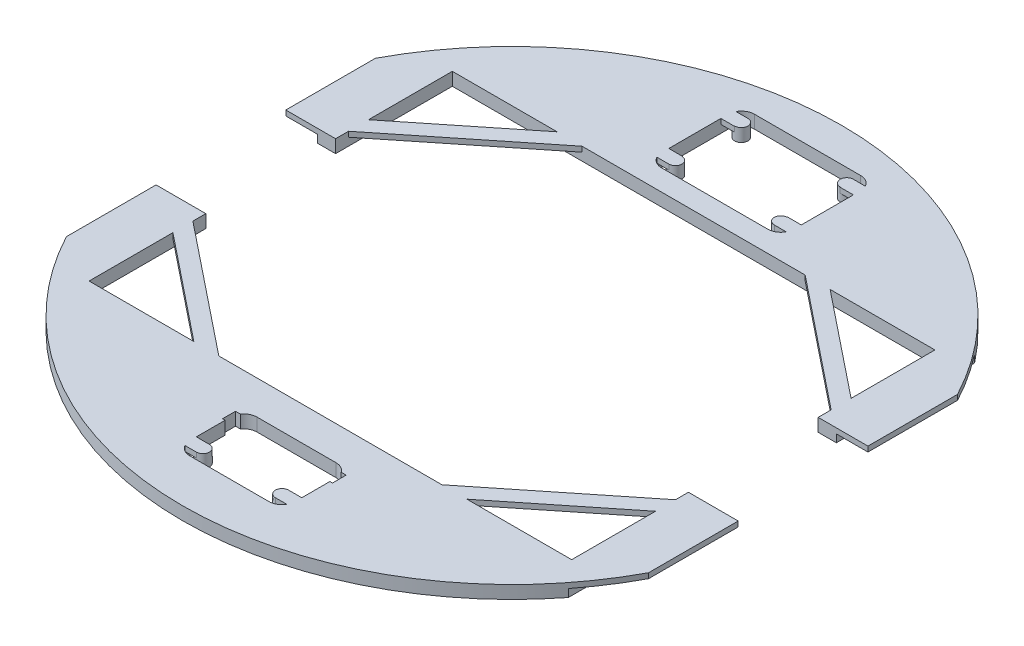
from build123d import *

# Parameters (mm, degrees)
SKETCH1_R           = 63.5
BOSS_EXTRUDE1_DEPTH = 2.5
CUT_EXTRUDE3_DEPTH  = 10
SKETCH2_W           = 93
SKETCH2_H           = 70
CUT_EXTRUDE4_DEPTH  = 1.5
CUT_EXTRUDE5_START  = -10
CUT_EXTRUDE5_DEPTH  = 10
SKETCH6_W           = 10
SKETCH6_H           = 26.950646815
CUT_EXTRUDE6_DEPTH  = 1.5
SKETCH7_R           = 1.27
CUT_EXTRUDE7_DEPTH  = 85.761427807
SKETCH8_W           = 2.6035
SKETCH8_H           = 2.6035
SKETCH8_W_2         = 2.54
SKETCH8_H_2         = 2.54
BOSS_EXTRUDE4_DEPTH = 1


with BuildPart() as part:
    # Sketch1 → Boss-Extrude1 (new body)
    with BuildSketch(Plane(origin=(0, 0, 0), x_dir=(1, 0, 0), z_dir=(0, 1, 0))):
        with Locations(Location((0, 0, 0), (0, 0, 270))):
            Circle(SKETCH1_R)
    extrude(amount=BOSS_EXTRUDE1_DEPTH)

    # Sketch4 → Cut-Extrude3 (cut)
    with BuildSketch(Plane(origin=(0, 2.5, 0), x_dir=(1, 0, 0), z_dir=(0, 1, 0))):
        Polygon((-46.5, 15), (-21.5, 35), (21.5, 35), (46.5, 15), (46.5, -15), (21.5, -35), (-21.5, -35), (-46.5, -15), align=None)
        Polygon((-46.5, 35), (-26.302343178, 35), (-46.5, 18.841874542), align=None)
        Polygon((-46.5, -35), (-26.302343178, -35), (-46.5, -18.841874542), align=None)
        Polygon((46.5, 35), (46.5, 18.841874542), (26.302343178, 35), align=None)
        Polygon((46.5, -18.841874542), (26.302343178, -35), (46.5, -35), align=None)
    extrude(amount=-CUT_EXTRUDE3_DEPTH, mode=Mode.SUBTRACT)

    # Sketch2 → Cut-Extrude4 (cut)
    with BuildSketch(Plane(origin=(0, 0, 0), x_dir=(1, 0, 0), z_dir=(0, 1, 0))):
        Rectangle(SKETCH2_W, SKETCH2_H)
    extrude(amount=CUT_EXTRUDE4_DEPTH, mode=Mode.SUBTRACT)

    # Sketch5 → Cut-Extrude5 (cut)
    with BuildSketch(Plane(origin=(0, 2.5, 0), x_dir=(1, 0, 0), z_dir=(0, 1, 0)).offset(CUT_EXTRUDE5_START)):
        with BuildLine():
            Line((-56.089211476, 12.5), (-46.5, 12.5))
            Line((-46.5, 12.5), (-46.5, -12.5))
            Line((-46.5, -12.5), (-56.089211476, -12.5))
            Line((-56.089211476, -12.5), (-56.089211476, -29.769957273))
            ThreePointArc((-56.089211476, -29.769957273), (-63.5, 0), (-56.089211476, 29.769957273))
            Line((-56.089211476, 29.769957273), (-56.089211476, 12.5))
        make_face()
        with BuildLine():
            Line((56.089211476, 12.5), (56.089211476, 29.769957273))
            ThreePointArc((56.089211476, 29.769957273), (63.5, 0), (56.089211476, -29.769957273))
            Line((56.089211476, -29.769957273), (56.089211476, -12.5))
            Line((56.089211476, -12.5), (46.5, -12.5))
            Line((46.5, -12.5), (46.5, 12.5))
            Line((46.5, 12.5), (56.089211476, 12.5))
        make_face()
    extrude(amount=CUT_EXTRUDE5_DEPTH, mode=Mode.SUBTRACT)


with BuildPart() as cut_extrude5_piece_1:
    # of the separate pieces the step leaves, piece 1, a body of its own (cut_extrude5_pieces)
    add(part.part.solids().sort_by_distance((56.089211476, 0, -29.769957273))[0])


with BuildPart() as cut_extrude5_piece_2:
    # of the separate pieces the step leaves, piece 2, a body of its own (cut_extrude5_pieces)
    add(part.part.solids().sort_by_distance((-56.089211476, 0, 29.769957273))[0])


with BuildPart() as cut_extrude6_tool:
    # Sketch6 → Cut-Extrude6 (new body)
    with BuildSketch(Plane.XZ):
        with Locations((55, -25.975323407)):
            Rectangle(SKETCH6_W, SKETCH6_H)
        with Locations((-55, -25.975323407)):
            Rectangle(SKETCH6_W, SKETCH6_H)
        with Locations((-55, 25.975323407)):
            Rectangle(SKETCH6_W, SKETCH6_H)
        with Locations((55, 25.975323407)):
            Rectangle(SKETCH6_W, SKETCH6_H)
    extrude(amount=-CUT_EXTRUDE6_DEPTH)


with BuildPart() as cut_extrude5_piece_1_1:
    add(cut_extrude5_piece_1.part)

    # Cut-Extrude6: cut by cut_extrude6_tool
    add(cut_extrude6_tool.part, mode=Mode.SUBTRACT)


with BuildPart() as cut_extrude5_piece_2_1:
    add(cut_extrude5_piece_2.part)

    # Cut-Extrude6: cut by cut_extrude6_tool
    add(cut_extrude6_tool.part, mode=Mode.SUBTRACT)


with BuildPart() as cut_extrude7_tool:
    # Sketch7 → Cut-Extrude7 (new, through all)
    # profile 1 of 2: a face of its own
    with BuildSketch(Plane(origin=(0, 2.5, 0), x_dir=(1, 0, 0), z_dir=(0, 1, 0))):
        with BuildLine():
            Line((-10.2235, 56.9535), (10.2235, 56.9535))
            ThreePointArc((10.2235, 56.9535), (12.019551224, 56.209551224), (12.7635, 54.4135))
            Line((12.7635, 54.4135), (12.7635, 41.5865))
            ThreePointArc((12.7635, 41.5865), (12.019551224, 39.790448776), (10.2235, 39.0465))
            Line((10.2235, 39.0465), (-10.2235, 39.0465))
            ThreePointArc((-10.2235, 39.0465), (-12.019551224, 39.790448776), (-12.7635, 41.5865))
            Line((-12.7635, 41.5865), (-12.7635, 54.4135))
            ThreePointArc((-12.7635, 54.4135), (-12.019551224, 56.209551224), (-10.2235, 56.9535))
        make_face()
        with Locations(Location((10.16, 54.35, 0), (0, 0, 270))):
            Circle(SKETCH7_R, mode=Mode.SUBTRACT)
        with Locations(Location((-10.16, 54.35, 0), (0, 0, 90))):
            Circle(SKETCH7_R, mode=Mode.SUBTRACT)
        with Locations(Location((10.16, 41.65, 0), (0, 0, 90))):
            Circle(SKETCH7_R, mode=Mode.SUBTRACT)
        with Locations(Location((-10.16, 41.65, 0), (0, 0, 270))):
            Circle(SKETCH7_R, mode=Mode.SUBTRACT)
    # profile 2 of 2: a face of its own
    with BuildSketch(Plane(origin=(0, 2.5, 0), x_dir=(1, 0, 0), z_dir=(0, 1, 0))):
        with BuildLine():
            Line((-7.62, -41.523), (7.62, -41.523))
            ThreePointArc((7.62, -41.523), (8.801947545, -41.814756241), (9.712367081, -42.623))
            Line((9.712367081, -42.623), (10.66, -42.623))
            Line((10.66, -42.623), (10.66, -45.25))
            Line((10.66, -45.25), (10.16, -45.25))
            Line((10.16, -45.25), (10.16, -51.937))
            ThreePointArc((10.16, -51.937), (9.416051224, -53.733051224), (7.62, -54.477))
            Line((7.62, -54.477), (-7.62, -54.477))
            ThreePointArc((-7.62, -54.477), (-9.416051224, -53.733051224), (-10.16, -51.937))
            Line((-10.16, -51.937), (-10.16, -45.123))
            Line((-10.16, -45.123), (-10.66, -45.123))
            Line((-10.66, -45.123), (-10.66, -42.623))
            Line((-10.66, -42.623), (-9.712367081, -42.623))
            ThreePointArc((-9.712367081, -42.623), (-8.801947545, -41.814756241), (-7.62, -41.523))
        make_face()
        with Locations(Location((-7.62, -51.937, 0), (0, 0, 270))):
            Circle(SKETCH7_R, mode=Mode.SUBTRACT)
        with Locations(Location((7.62, -51.937, 0), (0, 0, 270))):
            Circle(SKETCH7_R, mode=Mode.SUBTRACT)
    extrude(amount=-CUT_EXTRUDE7_DEPTH)


with BuildPart() as cut_extrude5_piece_1_2:
    add(cut_extrude5_piece_1_1.part)

    # Cut-Extrude7: cut by cut_extrude7_tool
    add(cut_extrude7_tool.part, mode=Mode.SUBTRACT)


with BuildPart() as cut_extrude5_piece_2_2:
    add(cut_extrude5_piece_2_1.part)

    # Cut-Extrude7: cut by cut_extrude7_tool
    add(cut_extrude7_tool.part, mode=Mode.SUBTRACT)


with BuildPart() as cut_extrude7_piece_1:
    # of the separate pieces the step leaves, piece 1, a body of its own (cut_extrude7_pieces)
    add(cut_extrude5_piece_1_2.part.solids().sort_by_distance((50, 0, -39.143965052))[0])



with BuildPart() as cut_extrude7_piece_2:
    # of the separate pieces the step leaves, piece 2, a body of its own (cut_extrude7_pieces)
    add(cut_extrude5_piece_1_2.part.solids().sort_by_distance((-10.16, 0, -40.38))[0])


with BuildPart() as cut_extrude7_piece_3:
    # of the separate pieces the step leaves, piece 3, a body of its own (cut_extrude7_pieces)
    add(cut_extrude5_piece_1_2.part.solids().sort_by_distance((-10.16, 0, -55.62))[0])


with BuildPart() as cut_extrude7_piece_4:
    # of the separate pieces the step leaves, piece 4, a body of its own (cut_extrude7_pieces)
    add(cut_extrude5_piece_1_2.part.solids().sort_by_distance((10.16, 0, -42.92))[0])


with BuildPart() as cut_extrude7_piece_5:
    # of the separate pieces the step leaves, piece 5, a body of its own (cut_extrude7_pieces)
    add(cut_extrude5_piece_1_2.part.solids().sort_by_distance((10.16, 0, -53.08))[0])


with BuildPart() as cut_extrude7_piece_1_of_cut_extrude5_pie:
    # of the separate pieces the step leaves, piece 1, a body of its own (cut_extrude7_pieces_of_cut_extrude5_piec)
    add(cut_extrude5_piece_2_2.part.solids().sort_by_distance((-50, 0, 39.143965052))[0])


with BuildPart() as cut_extrude7_piece_2_of_cut_extrude5_pie:
    # of the separate pieces the step leaves, piece 2, a body of its own (cut_extrude7_pieces_of_cut_extrude5_piec)
    add(cut_extrude5_piece_2_2.part.solids().sort_by_distance((-7.62, 0, 53.207))[0])


with BuildPart() as cut_extrude7_piece_3_of_cut_extrude5_pie:
    # of the separate pieces the step leaves, piece 3, a body of its own (cut_extrude7_pieces_of_cut_extrude5_piec)
    add(cut_extrude5_piece_2_2.part.solids().sort_by_distance((7.62, 0, 53.207))[0])


with BuildPart() as cut_extrude7_piece_1_1:
    add(cut_extrude7_piece_1.part)

    add(cut_extrude7_piece_2.part)  # Boss-Extrude4 merges Cut-Extrude7 piece 2

    add(cut_extrude7_piece_3.part)  # Boss-Extrude4 merges Cut-Extrude7 piece 3

    add(cut_extrude7_piece_4.part)  # Boss-Extrude4 merges Cut-Extrude7 piece 4

    add(cut_extrude7_piece_5.part)  # Boss-Extrude4 merges Cut-Extrude7 piece 5

    add(cut_extrude7_piece_1_of_cut_extrude5_pie.part)  # Boss-Extrude4 merges Cut-Extrude7 piece 1 of Cut-Extrude5 pie

    add(cut_extrude7_piece_2_of_cut_extrude5_pie.part)  # Boss-Extrude4 merges Cut-Extrude7 piece 2 of Cut-Extrude5 pie

    add(cut_extrude7_piece_3_of_cut_extrude5_pie.part)  # Boss-Extrude4 merges Cut-Extrude7 piece 3 of Cut-Extrude5 pie
    # Sketch8 → Boss-Extrude4 (add)
    with BuildSketch(Plane(origin=(0, 2.5, 0), x_dir=(1, 0, 0), z_dir=(0, 1, 0))):
        with Locations((11.46175, 54.31825)):
            Rectangle(SKETCH8_W, SKETCH8_H)
        with Locations((-11.46175, 54.31825)):
            Rectangle(SKETCH8_W, SKETCH8_H)
        with Locations((-11.46175, 41.68175)):
            Rectangle(SKETCH8_W, SKETCH8_H)
        with Locations((11.46175, 41.68175)):
            Rectangle(SKETCH8_W, SKETCH8_H)
        with Locations((-8.89, -51.937)):
            Rectangle(SKETCH8_W_2, SKETCH8_H_2)
        with Locations((8.89, -51.937)):
            Rectangle(SKETCH8_W_2, SKETCH8_H_2)
    extrude(amount=-BOSS_EXTRUDE4_DEPTH)


solid = cut_extrude7_piece_1_1.part
